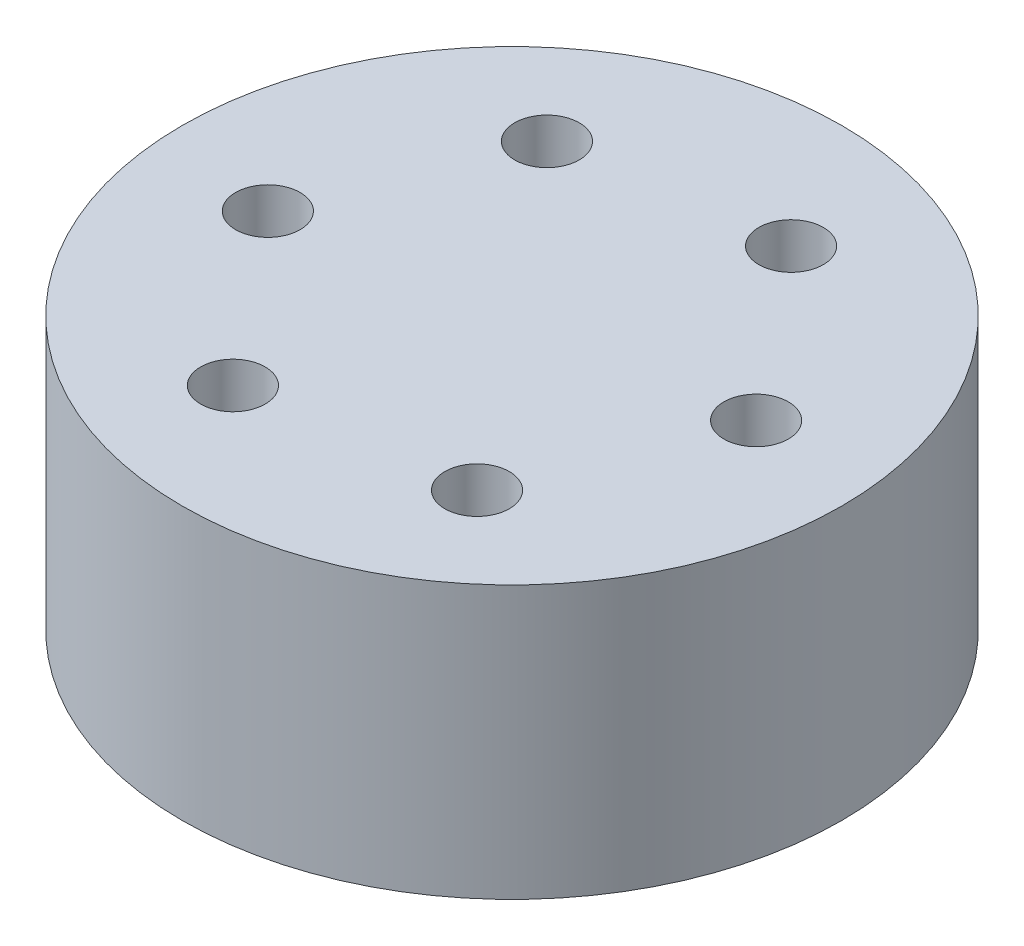
from build123d import *

# Parameters (mm, degrees)
CUBO_START            = 27.75
SK_CUBO_R             = 23
CUBO_DEPTH            = 19
PASANTES_M4_START     = 27.75
SK_PASANTES_M4_R      = 2.25
PASANTES_M4_DEPTH     = 19
CENTRADOR_D42_START   = 27.75
SK_CENTRADOR_D42_R    = 21.2
CENTRADOR_D42_DEPTH   = 1.2
PASADORES_MOTOR_START = 27.75
SK_PASADORES_MOTOR_R  = 2.6
PASADORES_MOTOR_DEPTH = 5


with BuildPart() as part:
    # Sk_Cubo → Cubo (new body)
    with BuildSketch(Plane(origin=(0, 0, 0), x_dir=(1, 0, 0), z_dir=(0, 1, 0)).offset(CUBO_START)):
        with Locations(Location((0, -170, 0), (0, 0, 270))):
            Circle(SK_CUBO_R)
    extrude(amount=CUBO_DEPTH)

    # Sk_Pasantes_M4 → Pasantes_M4 (cut)
    with BuildSketch(Plane(origin=(0, 0, 0), x_dir=(1, 0, 0), z_dir=(0, 1, 0)).offset(PASANTES_M4_START)):
        with Locations(Location((14.839084994, -167.808754572, 0), (0, 0, 270))):
            Circle(SK_PASANTES_M4_R)
        with Locations(Location((9.317216704, -181.75540186, 0), (0, 0, 270))):
            Circle(SK_PASANTES_M4_R)
        with Locations(Location((-5.52186829, -183.946647288, 0), (0, 0, 270))):
            Circle(SK_PASANTES_M4_R)
        with Locations(Location((-14.839084994, -172.191245428, 0), (0, 0, 270))):
            Circle(SK_PASANTES_M4_R)
        with Locations(Location((-9.317216704, -158.24459814, 0), (0, 0, 270))):
            Circle(SK_PASANTES_M4_R)
        with Locations(Location((5.52186829, -156.053352712, 0), (0, 0, 270))):
            Circle(SK_PASANTES_M4_R)
    extrude(amount=PASANTES_M4_DEPTH, mode=Mode.SUBTRACT)

    # Sk_Centrador_D42 → Centrador_D42 (cut)
    with BuildSketch(Plane(origin=(0, 0, 0), x_dir=(1, 0, 0), z_dir=(0, 1, 0)).offset(CENTRADOR_D42_START)):
        with Locations(Location((0, -170, 0), (0, 0, 270))):
            Circle(SK_CENTRADOR_D42_R)
    extrude(amount=CENTRADOR_D42_DEPTH, mode=Mode.SUBTRACT)

    # Sk_Pasadores_motor → Pasadores_motor (cut)
    with BuildSketch(Plane(origin=(0, 0, 0), x_dir=(1, 0, 0), z_dir=(0, 1, 0)).offset(PASADORES_MOTOR_START)):
        with Locations(Location((13.295803748, -175.264181103, 0), (0, 0, 270))):
            Circle(SK_PASADORES_MOTOR_R)
        with Locations(Location((-11.20681644, -178.882413258, 0), (0, 0, 270))):
            Circle(SK_PASADORES_MOTOR_R)
        with Locations(Location((-2.088987308, -155.853405639, 0), (0, 0, 270))):
            Circle(SK_PASADORES_MOTOR_R)
    extrude(amount=PASADORES_MOTOR_DEPTH, mode=Mode.SUBTRACT)


solid = part.part
